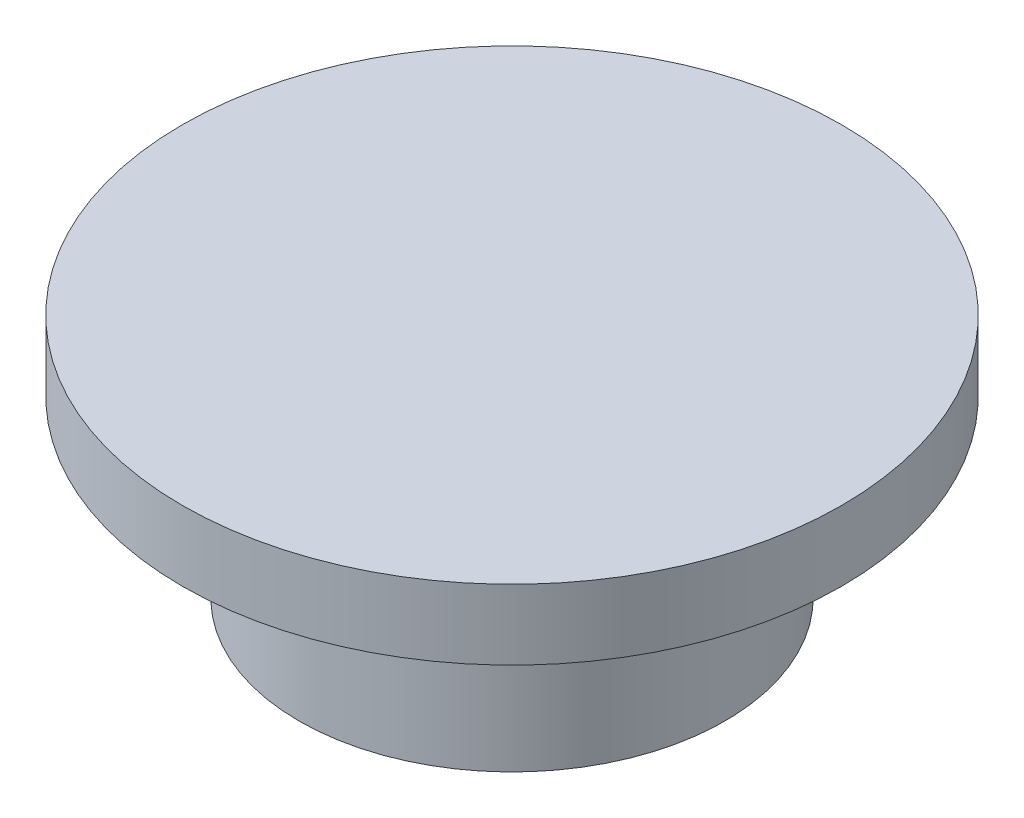
from build123d import *

# Parameters (mm, degrees)
SKETCH_2_R      = 5.589622462
EXTRUDE_1_DEPTH = 0.4


with BuildPart() as part:
    # Эскиз1 → Повернуть1 (revolve)
    with BuildSketch(Plane.XY, mode=Mode.PRIVATE) as revolve_1_sk:
        Polygon((5.3, 0), (5.3, 8.4), (11.3, 8.4), (11.3, 6), (7.3, 6), (7.3, 0), align=None)
    revolve(revolve_1_sk.sketch.rotate(Axis((0, 0, 0), (0, 1, 0)), 90), axis=Axis((0, 0, 0), (0, 1, 0)))

    # Эскиз2 → Бобышка-Вытянуть1 (add)
    with BuildSketch(Plane(origin=(0, 8.4, 0), x_dir=(1, 0, 0), z_dir=(0, 1, 0))):
        Circle(SKETCH_2_R)
    extrude(amount=-EXTRUDE_1_DEPTH)


solid = part.part
